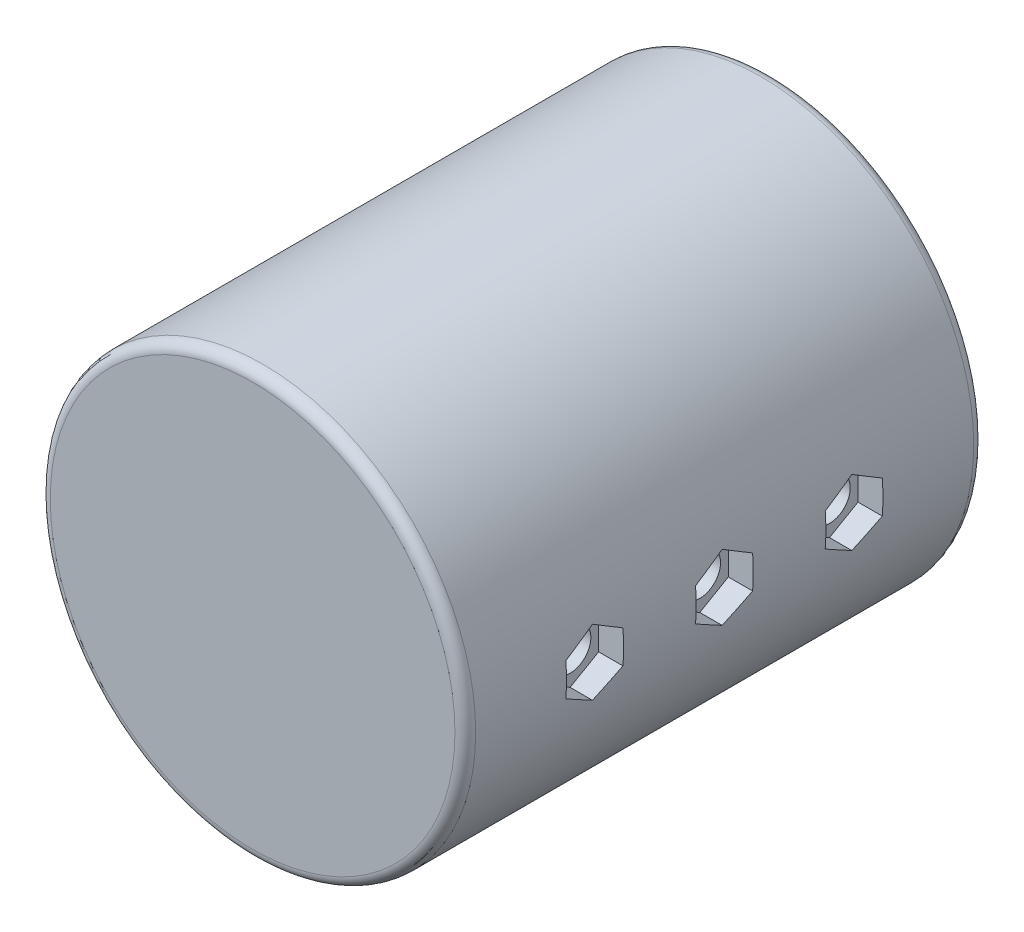
from build123d import *

# Parameters (mm, degrees)
SKETCH_1_R          = 20.5
EXTRUDE_1_DEPTH     = 50
FILLET_1_R          = 1
FILLET_2_R          = 1
SKETCH_2_R          = 2
CUT_EXTRUDE_1_DEPTH = 68.832514358
CUT_EXTRUDE_2_DEPTH = 2.4


with BuildPart() as part:
    # Эскиз1 → Бобышка-Вытянуть1 (new body)
    with BuildSketch(Plane.XY):
        Circle(SKETCH_1_R)
    extrude(amount=EXTRUDE_1_DEPTH)

    # Скругление1
    fillet_1_edges = [part.edges().sort_by_distance(p)[0] for p in [
        (-20.5, 0, 50),
    ]]
    fillet(fillet_1_edges, radius=FILLET_1_R)

    # Скругление2
    fillet_2_edges = [part.edges().sort_by_distance(p)[0] for p in [
        (-20.5, 0, 0),
    ]]
    fillet(fillet_2_edges, radius=FILLET_2_R)

    # Эскиз2 → Вырез-Вытянуть1 (cut, through all)
    with BuildSketch(Plane(origin=(20.5, 0, 0), x_dir=(0, 0, -1), z_dir=(1, 0, 0))):
        with Locations((-37.5, 0)):
            Circle(SKETCH_2_R)
        with Locations((-25, 0)):
            Circle(SKETCH_2_R)
        with Locations((-12.5, 0)):
            Circle(SKETCH_2_R)
    extrude(amount=-CUT_EXTRUDE_1_DEPTH, mode=Mode.SUBTRACT)

    # Эскиз3 → Вырез-Вытянуть2 (cut)
    with BuildSketch(Plane(origin=(20.5, 0, 0), x_dir=(0, 0, -1), z_dir=(1, 0, 0))):
        Polygon((-25, 3.175426481), (-27.75, 1.58771324), (-27.75, -1.58771324), (-25, -3.175426481), (-22.25, -1.58771324), (-22.25, 1.58771324), align=None)
        Polygon((-37.5, 3.175426481), (-40.25, 1.58771324), (-40.25, -1.58771324), (-37.5, -3.175426481), (-34.75, -1.58771324), (-34.75, 1.58771324), align=None)
        Polygon((-12.5, 3.175426481), (-15.25, 1.58771324), (-15.25, -1.58771324), (-12.5, -3.175426481), (-9.75, -1.58771324), (-9.75, 1.58771324), align=None)
    cut_extrude_2 = extrude(amount=-CUT_EXTRUDE_2_DEPTH, mode=Mode.SUBTRACT)

    # Зеркальное отражение1: Вырез-Вытянуть2 across plane
    add(cut_extrude_2.mirror(Plane(origin=(0, 0, 0), x_dir=(0, 0, 1), z_dir=(1, 0, 0))), mode=Mode.SUBTRACT)


solid = part.part
